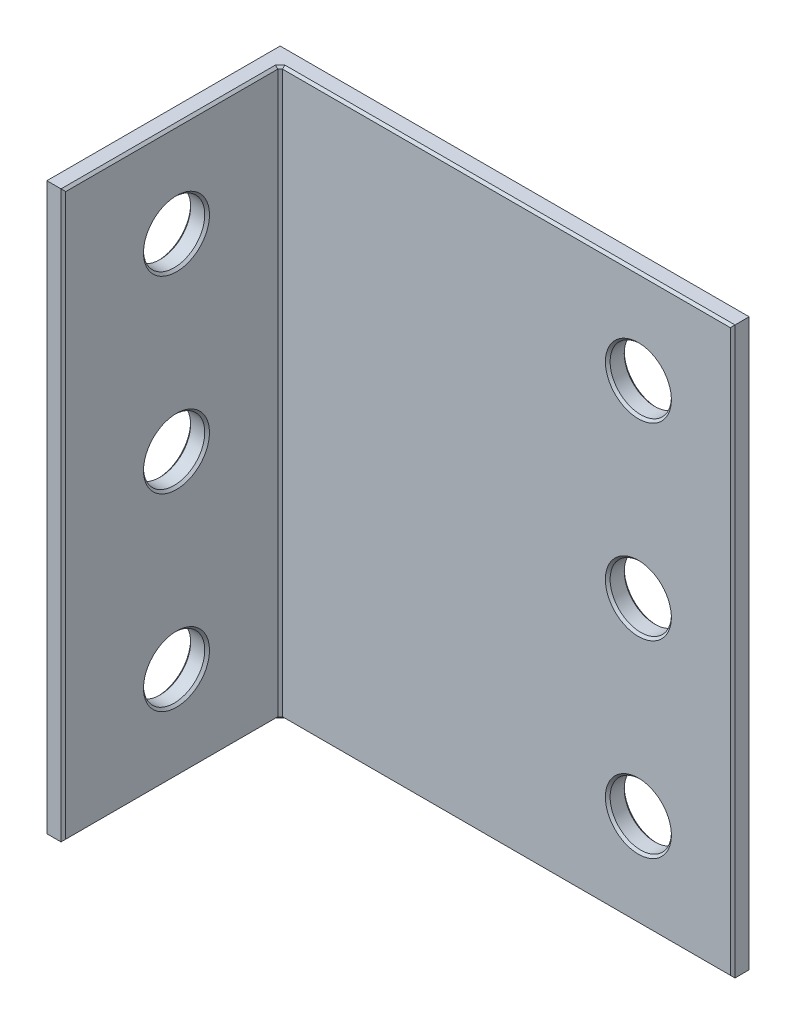
from build123d import *

# Parameters (mm, degrees)
SKETCH_1_W          = 200
SKETCH_1_H          = 240
SKETCH_1_R          = 13
EXTRUDE_326_DEPTH   = 8
SKETCH_2_W          = 8
SKETCH_2_H          = 240
EXTRUDE_1_DEPTH     = 92
SKETCH_3_R          = 13
CUT_EXTRUDE_1_DEPTH = 329.024389337
CHAMFER_1_SIZE      = 1


with BuildPart() as part:
    # 草图1 → Extrude 326 (new body)
    with BuildSketch(Plane.XY):
        with Locations((100, 120)):
            Rectangle(SKETCH_1_W, SKETCH_1_H)
        with Locations((160, 40)):
            Circle(SKETCH_1_R, mode=Mode.SUBTRACT)
        with Locations((160, 120)):
            Circle(SKETCH_1_R, mode=Mode.SUBTRACT)
        with Locations((160, 200)):
            Circle(SKETCH_1_R, mode=Mode.SUBTRACT)
    extrude(amount=EXTRUDE_326_DEPTH)

    # 草图2 → 凸台-拉伸1 (add)
    with BuildSketch(Plane.XY.offset(8)):
        with Locations((4, 120)):
            Rectangle(SKETCH_2_W, SKETCH_2_H)
    extrude(amount=EXTRUDE_1_DEPTH)

    # 草图3 → 切除-拉伸1 (cut, through all)
    with BuildSketch(Plane.ZY):
        with Locations((52, 200)):
            Circle(SKETCH_3_R)
        with Locations((52, 120)):
            Circle(SKETCH_3_R)
        with Locations((52, 40)):
            Circle(SKETCH_3_R)
    extrude(amount=-CUT_EXTRUDE_1_DEPTH, mode=Mode.SUBTRACT)

    # 倒角1
    chamfer_1_edges = [part.edges().sort_by_distance(p)[0] for p in [
        (200, 120, 8),
        (147, 40, 0),
        (147, 40, 8),
        (104, 240, 8),
        (147, 120, 0),
        (147, 120, 8),
        (147, 200, 0),
        (147, 200, 8),
        (104, 0, 8),
        (8, 120, 8),
        (8, 0, 54),
        (8, 240, 54),
        (0, 120, 100),
        (8, 120, 100),
        (8, 200, 39),
        (0, 200, 39),
        (100, 240, 0),
        (8, 120, 39),
        (0, 120, 39),
        (200, 120, 0),
        (8, 40, 39),
        (0, 40, 39),
        (100, 0, 0),
        (0, 120, 0),
        (0, 240, 50),
        (0, 0, 50),
    ]]
    chamfer(chamfer_1_edges, length=CHAMFER_1_SIZE)


solid = part.part
